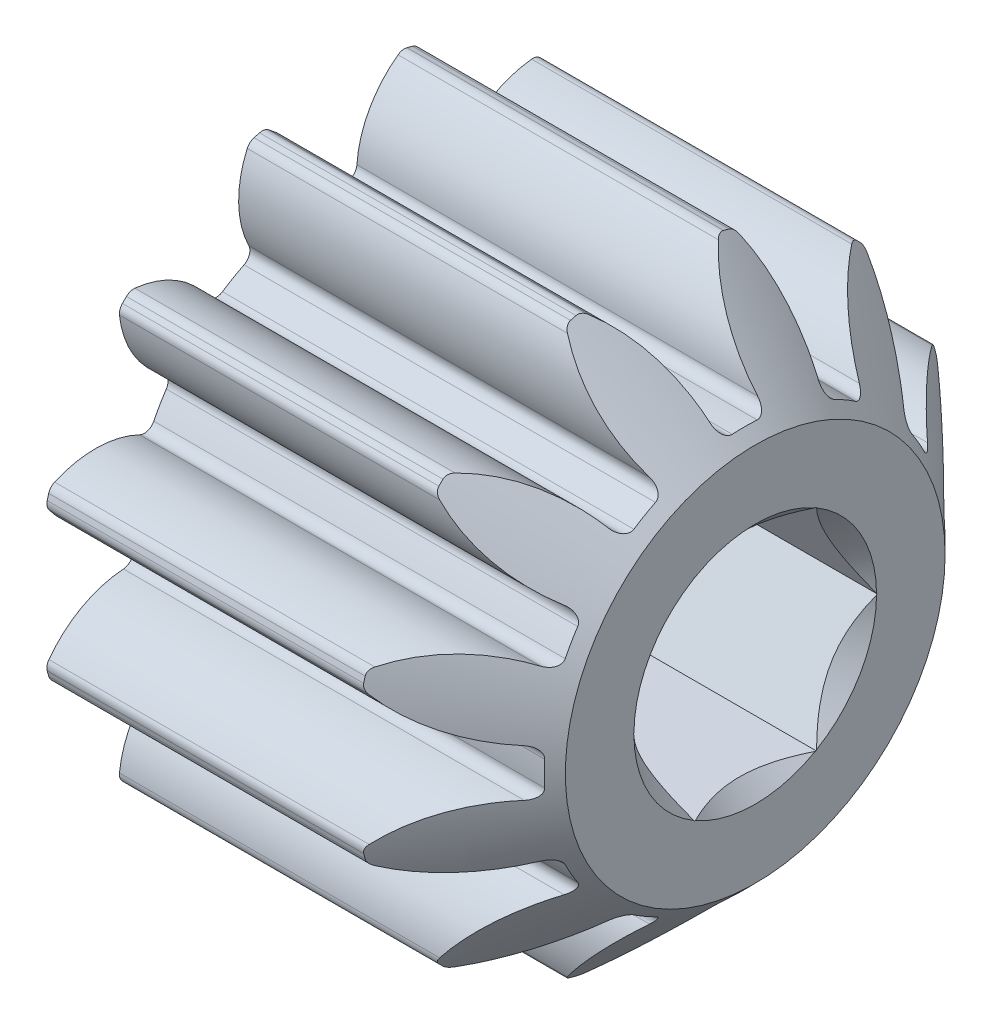
from build123d import *

# Parameters (mm, degrees)
BASPROSKE_W         = 20
BASPROSKE_H         = 14
TOOTHCUT_DEPTH      = 29.142494559
TEETHCUTS_COUNT     = 12
TEETHCUTS_ANGLE     = 330
BORSKE_R            = 3
BORE_DEPTH          = 50.0000508
FILLET_1_R          = 0.5
CUT_EXTRUDE_1_DEPTH = 28.760189445
SKETCH_2_OUTSIDE_W  = 57.904
SKETCH_2_OUTSIDE_H  = 57.904
SKETCH_2_OUTSIDE_R  = 9
CUT_EXTRUDE_2_DEPTH = 10
CUT_EXTRUDE_2_DRAFT = -45
FILLET_2_R          = 0.5


with BuildPart() as part:
    # BasProSke → Base-Revolve (revolve)
    with BuildSketch(Plane(origin=(0, 0, 0), x_dir=(1, 0, 0), z_dir=(0, 1, 0)), mode=Mode.PRIVATE) as base_revolve_sk:
        with Locations((10, 7)):
            Rectangle(BASPROSKE_W, BASPROSKE_H)
    revolve(base_revolve_sk.sketch.rotate(Axis((-10, 0, 0), (1, 0, 0)), 180), axis=Axis((-10, 0, 0), (1, 0, 0)))

    # TooCutSke → ToothCut (cut, through all)
    with BuildSketch(Plane(origin=(0, 0, 0), x_dir=(0, 0, -1), z_dir=(1, 0, 0))):
        with BuildLine():
            ThreePointArc((1.111908866, 9.433698091), (0, 9.499), (-1.111908866, 9.433698091))
            ThreePointArc((-1.111908866, 9.433698091), (-1.651516138, 11.821129337), (-3.298149691, 13.632096456))
            ThreePointArc((-3.298149691, 13.632096456), (0, 14.0254), (3.298149691, 13.632096456))
            ThreePointArc((3.298149691, 13.632096456), (1.651516138, 11.821129337), (1.111908866, 9.433698091))
        make_face()
    toothcut = extrude(amount=TOOTHCUT_DEPTH, mode=Mode.SUBTRACT)

    # TeethCuts: ToothCut ×12 about axis
    teethcuts_axis = Axis((-10, 0, 0), (1, 0, 0))
    for i in range(1, TEETHCUTS_COUNT):
        add(toothcut.rotate(teethcuts_axis, i * TEETHCUTS_ANGLE / (TEETHCUTS_COUNT - 1)), mode=Mode.SUBTRACT)

    # BorSke → Bore (cut, symmetric)
    with BuildSketch(Plane(origin=(0, 0, 0), x_dir=(0, 0, -1), z_dir=(1, 0, 0))):
        with Locations(Location((0, 0, 0), (0, 0, 180))):
            Circle(BORSKE_R)
    extrude(amount=BORE_DEPTH, both=True, mode=Mode.SUBTRACT)

    # Скругление1
    fillet_1_edges = [part.edges().sort_by_distance(p)[0] for p in [
        (10, 1.111908866, 9.433698091),
        (10, -1.111908866, 9.433698091),
        (10, -9.433698091, 1.111908866),
        (10, -9.433698091, -1.111908866),
        (10, -7.613867765, 5.67979037),
        (10, -8.725776632, 3.753907721),
        (10, -3.753907721, 8.725776632),
        (10, -5.67979037, 7.613867765),
        (10, 9.433698091, -1.111908866),
        (10, -5.67979037, -7.613867765),
        (10, -3.753907721, -8.725776632),
        (10, -8.725776632, -3.753907721),
        (10, -7.613867765, -5.67979037),
        (10, -1.111908866, -9.433698091),
        (10, 1.111908866, -9.433698091),
        (10, 9.433698091, 1.111908866),
        (10, 7.613867765, -5.67979037),
        (10, 8.725776632, -3.753907721),
        (10, 3.753907721, -8.725776632),
        (10, 5.67979037, -7.613867765),
        (10, 8.725776632, 3.753907721),
        (10, 7.613867765, 5.67979037),
        (10, 5.67979037, 7.613867765),
        (10, 3.753907721, 8.725776632),
    ]]
    fillet(fillet_1_edges, radius=FILLET_1_R)

    # Эскиз1 → Вырез-Вытянуть1 (cut, through all)
    with BuildSketch(Plane(origin=(20, 0, 0), x_dir=(0, 0, -1), z_dir=(1, 0, 0))):
        Polygon((2.886751346, 5), (-2.886751346, 5), (-5.773502692, 0), (-2.886751346, -5), (2.886751346, -5), (5.773502692, 0), align=None)
    extrude(amount=-CUT_EXTRUDE_1_DEPTH, mode=Mode.SUBTRACT)


with BuildPart() as cut_extrude_2_tool:
    # Эскиз2 outside → Вырез-Вытянуть2 (with draft: the straight prism first)
    with BuildSketch(Plane(origin=(20, 0, 0), x_dir=(0, 0, -1), z_dir=(1, 0, 0))):
        Rectangle(SKETCH_2_OUTSIDE_W, SKETCH_2_OUTSIDE_H)
        Circle(SKETCH_2_OUTSIDE_R, mode=Mode.SUBTRACT)
    extrude(amount=-CUT_EXTRUDE_2_DEPTH)
    # Вырез-Вытянуть2: the draft: its side faces are tilted about the plane it starts from
    cut_extrude_2_sides = [cut_extrude_2_tool.faces().sort_by_distance(p)[0] for p in [
        (15, -28.952, 0),
        (15, 0, -28.952),
        (15, 28.952, 0),
        (15, 0, 28.952),
        (15, 0, 9),
    ]]
    draft(cut_extrude_2_sides, Plane(origin=(20, 0, 0), x_dir=(0, 0, -1), z_dir=(1, 0, 0)), CUT_EXTRUDE_2_DRAFT)


with BuildPart() as part_1:
    add(part.part)

    # Вырез-Вытянуть2: cut by cut_extrude_2_tool
    add(cut_extrude_2_tool.part, mode=Mode.SUBTRACT)

    # Скругление2
    fillet_2_edges = [part_1.edges().sort_by_distance(p)[0] for p in [
        (7.5, 3.268936482, 13.613010478),
        (7.5, -3.268936482, 13.613010478),
        (7.5, -3.975523202, 13.423681137),
        (7.5, -9.637487276, 10.154744655),
        (7.5, -10.154744655, 9.637487276),
        (7.5, -13.423681137, 3.975523202),
        (7.5, -13.613010478, 3.268936482),
        (7.5, -13.613010478, -3.268936482),
        (7.5, -13.423681137, -3.975523202),
        (7.5, -10.154744655, -9.637487276),
        (7.5, -9.637487276, -10.154744655),
        (7.5, -3.975523202, -13.423681137),
        (7.5, -3.268936482, -13.613010478),
        (7.5, 3.268936482, -13.613010478),
        (7.5, 3.975523202, -13.423681137),
        (7.5, 9.637487276, -10.154744655),
        (7.5, 10.154744655, -9.637487276),
        (7.5, 13.423681137, -3.975523202),
        (7.5, 13.613010478, -3.268936482),
        (7.5, 13.613010478, 3.268936482),
        (7.5, 13.423681137, 3.975523202),
        (7.5, 10.154744655, 9.637487276),
        (7.5, 9.637487276, 10.154744655),
        (7.5, 3.975523202, 13.423681137),
    ]]
    fillet(fillet_2_edges, radius=FILLET_2_R)

    # Вырез-Вытянуть3 cone 1 section (through the dimple's axis) → Вырез-Вытянуть3 (revolve, cut)
    with BuildSketch(Plane(origin=(20, 0, 0), x_dir=(0, 0, -1), z_dir=(0, 1, 0))):
        Polygon((0, 0), (5.75, 0), (0, 5.75), align=None)
    revolve(axis=Axis((20, 0, 0), (-1, 0, 0)), mode=Mode.SUBTRACT)


solid = part_1.part
